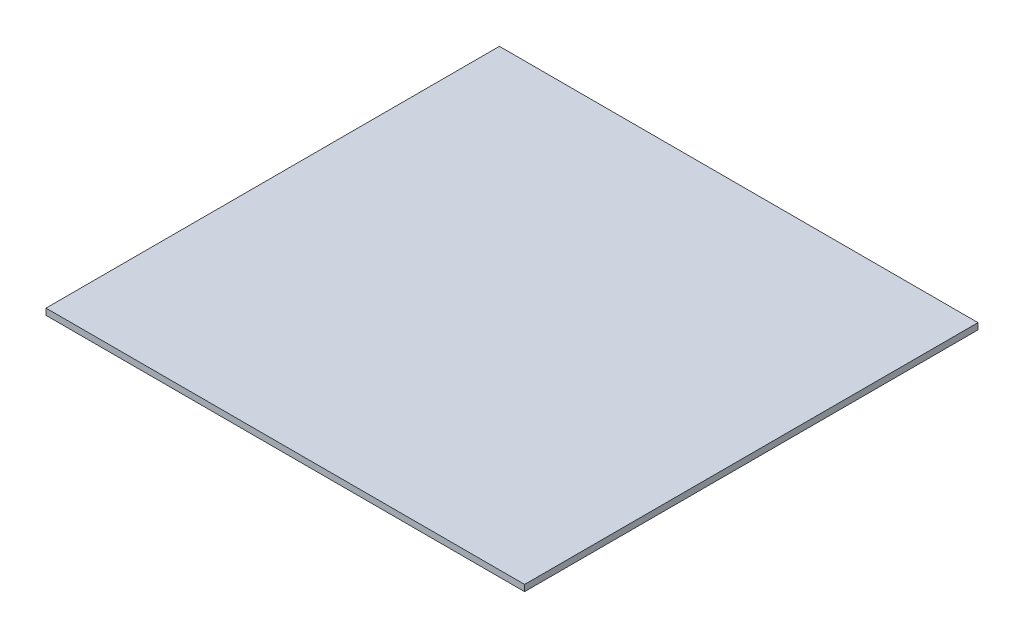
from build123d import *

# Parameters (mm, degrees)
SKETCH1_W           = 965.2
SKETCH1_H           = 914.4
BOSS_EXTRUDE1_DEPTH = 12.7


with BuildPart() as part:
    # Sketch1 → Boss-Extrude1 (new body)
    with BuildSketch(Plane(origin=(0, 0, 0), x_dir=(1, 0, 0), z_dir=(0, 1, 0))):
        with Locations((482.6, 457.2)):
            Rectangle(SKETCH1_W, SKETCH1_H)
    extrude(amount=BOSS_EXTRUDE1_DEPTH)


solid = part.part
